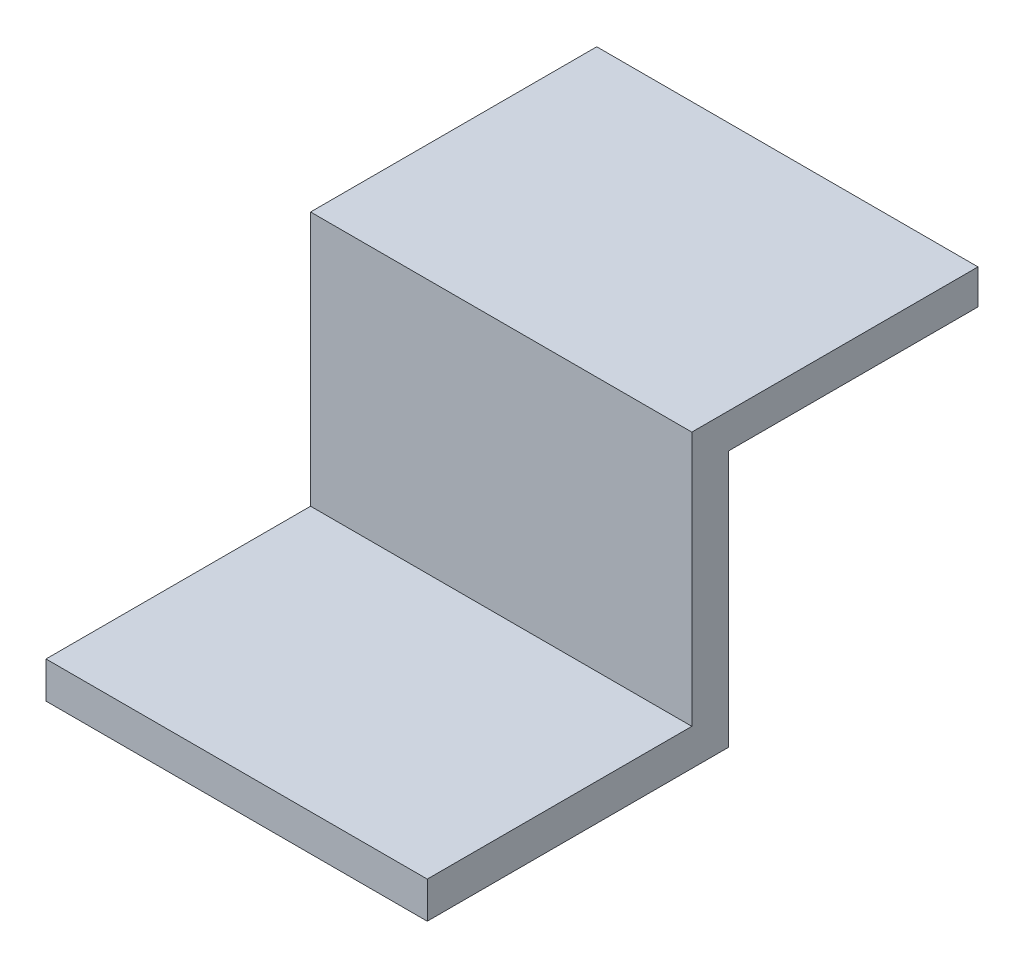
from build123d import *

# Parameters (mm, degrees)
EXTRUDE4_DEPTH = 66.294


with BuildPart() as part:
    # Sketch10 → Extrude4 (new body)
    with BuildSketch(Plane(origin=(0, 0, 0), x_dir=(0, 0, -1), z_dir=(1, 0, 0))):
        Polygon((52.353300196, 44.627176404), (52.353300196, 0), (0, 0), (0, 6.35), (46.003300196, 6.35), (46.003300196, 50.658753449), (52.353300196, 50.658753449), (95.762817201, 50.658753449), (95.762817201, 44.627176404), align=None)
    extrude(amount=-EXTRUDE4_DEPTH)


solid = part.part
